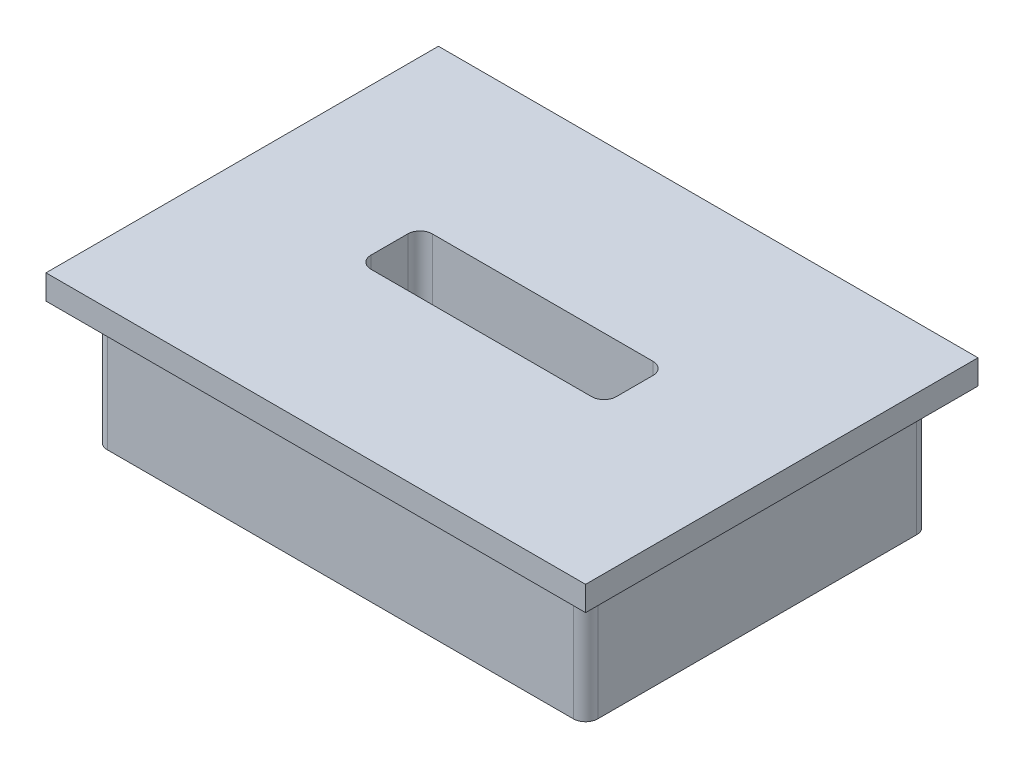
from build123d import *

# Parameters (mm, degrees)
SKETCH1_W           = 20
SKETCH1_H           = 14
SKETCH1_W_2         = 10
SKETCH1_H_2         = 2.5
BOSS_EXTRUDE1_DEPTH = 5
SKETCH2_W           = 22
SKETCH2_H           = 16
SKETCH2_W_2         = 10
SKETCH2_H_2         = 2.5
BOSS_EXTRUDE2_DEPTH = 1
FILLET1_R           = 0.5


with BuildPart() as part:
    # Sketch1 → Boss-Extrude1 (new body)
    with BuildSketch(Plane(origin=(0, 0, 0), x_dir=(1, 0, 0), z_dir=(0, 1, 0))):
        with Locations((10, -7)):
            Rectangle(SKETCH1_W, SKETCH1_H)
        with Locations((10, -7)):
            Rectangle(SKETCH1_W_2, SKETCH1_H_2, mode=Mode.SUBTRACT)
    extrude(amount=BOSS_EXTRUDE1_DEPTH)

    # Sketch2 → Boss-Extrude2 (add)
    with BuildSketch(Plane(origin=(0, 5, 0), x_dir=(1, 0, 0), z_dir=(0, 1, 0))):
        with Locations((10, -7)):
            Rectangle(SKETCH2_W, SKETCH2_H)
        with Locations((10, -7)):
            Rectangle(SKETCH2_W_2, SKETCH2_H_2, mode=Mode.SUBTRACT)
    extrude(amount=BOSS_EXTRUDE2_DEPTH)

    # Fillet1
    fillet1_edges = [part.edges().sort_by_distance(p)[0] for p in [
        (15, 3, 8.25),
        (15, 3, 5.75),
        (5, 3, 5.75),
        (5, 3, 8.25),
        (0, 2.5, 0),
        (20, 2.5, 0),
        (20, 2.5, 14),
        (0, 2.5, 14),
    ]]
    fillet(fillet1_edges, radius=FILLET1_R)


solid = part.part
